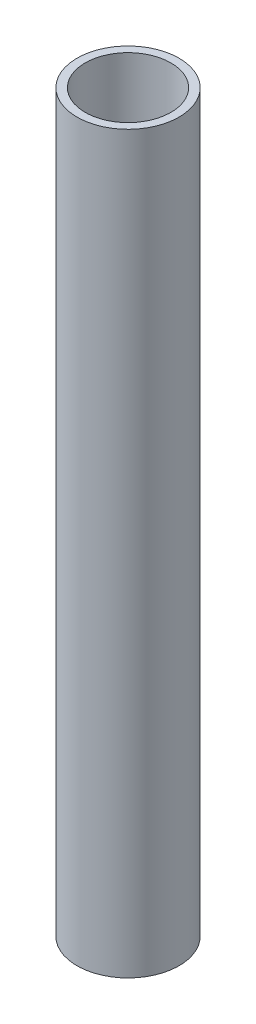
from build123d import *

# Parameters (mm, degrees)
SKETCH_1_R      = 12.5
SKETCH_1_R_2    = 10.5
EXTRUDE_1_DEPTH = 180


with BuildPart() as part:
    # 草图1 → 凸台-拉伸1 (new body)
    with BuildSketch(Plane(origin=(0, 0, 0), x_dir=(1, 0, 0), z_dir=(0, 1, 0))):
        with Locations(Location((0, 0, 0), (0, 0, 90))):
            Circle(SKETCH_1_R)
        with Locations(Location((0, 0, 0), (0, 0, 90))):
            Circle(SKETCH_1_R_2, mode=Mode.SUBTRACT)
    extrude(amount=EXTRUDE_1_DEPTH)


solid = part.part
